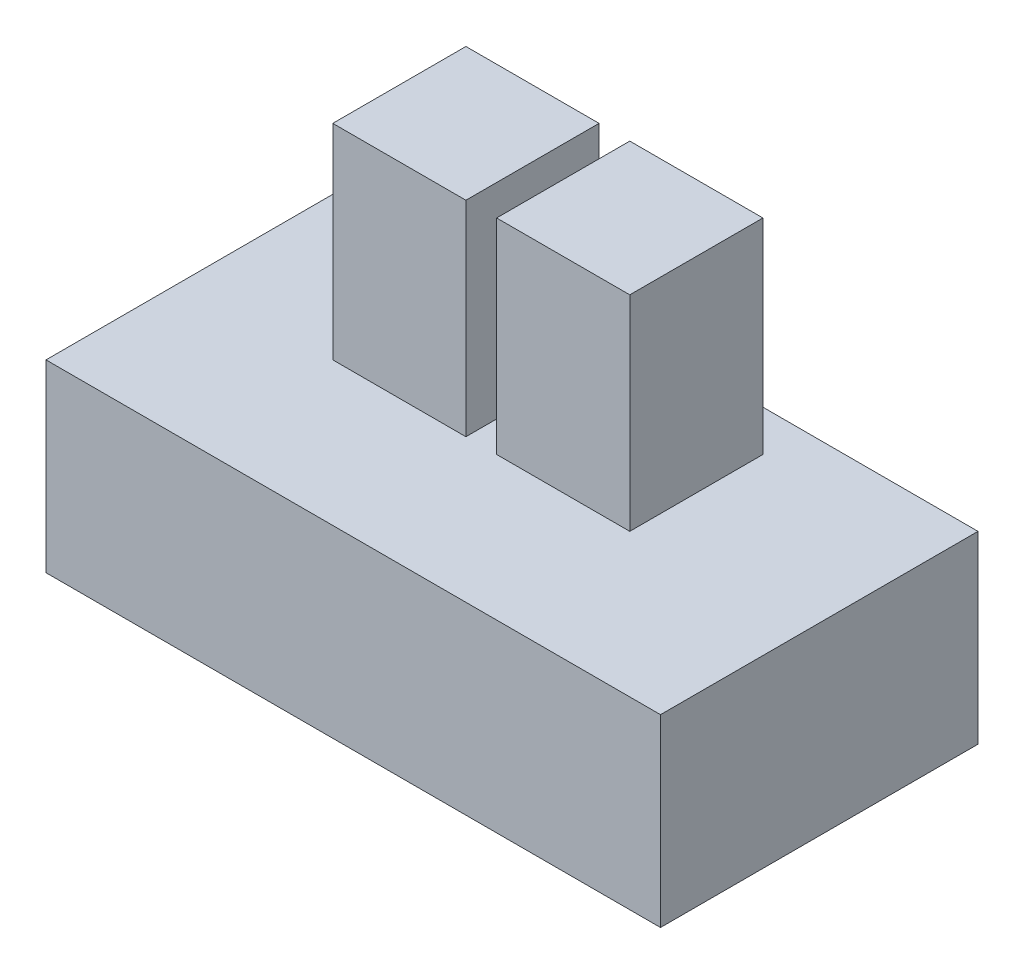
from build123d import *

# Parameters (mm, degrees)
SCHIZZO1_W                   = 60
SCHIZZO1_H                   = 31
ESTRUSIONE_ESTRUSIONE1_DEPTH = 18
SCHIZZO2_W                   = 13
SCHIZZO2_H                   = 13
ESTRUSIONE_ESTRUSIONE2_DEPTH = 20
SCHIZZO3_W                   = 3
SCHIZZO3_H                   = 3
TAGLIO_ESTRUSIONE1_DEPTH     = 5


with BuildPart() as part:
    # Schizzo1 → Estrusione-Estrusione1 (new body)
    with BuildSketch(Plane(origin=(0, 0, 0), x_dir=(1, 0, 0), z_dir=(0, 1, 0))):
        with Locations((-10.807034353, -6.614779908)):
            Rectangle(SCHIZZO1_W, SCHIZZO1_H)
    extrude(amount=ESTRUSIONE_ESTRUSIONE1_DEPTH)

    # Schizzo2 → Estrusione-Estrusione2 (add)
    with BuildSketch(Plane(origin=(0, 18, 0), x_dir=(1, 0, 0), z_dir=(0, 1, 0))):
        with Locations((-20.307034353, -1.614779908)):
            Rectangle(SCHIZZO2_W, SCHIZZO2_H)
        with Locations((-4.307034353, -1.614779908)):
            Rectangle(SCHIZZO2_W, SCHIZZO2_H)
    extrude(amount=ESTRUSIONE_ESTRUSIONE2_DEPTH)

    # Schizzo3 → Taglio-Estrusione1 (cut)
    with BuildSketch(Plane.ZY.offset(40.807034353)):
        with Locations((-2.885220092, 7.5)):
            Rectangle(SCHIZZO3_W, SCHIZZO3_H)
        with Locations((2.614779908, 7.5)):
            Rectangle(SCHIZZO3_W, SCHIZZO3_H)
        with Locations((10.614779908, 7.5)):
            Rectangle(SCHIZZO3_W, SCHIZZO3_H)
        with Locations((16.114779908, 7.5)):
            Rectangle(SCHIZZO3_W, SCHIZZO3_H)
    extrude(amount=-TAGLIO_ESTRUSIONE1_DEPTH, mode=Mode.SUBTRACT)


solid = part.part
